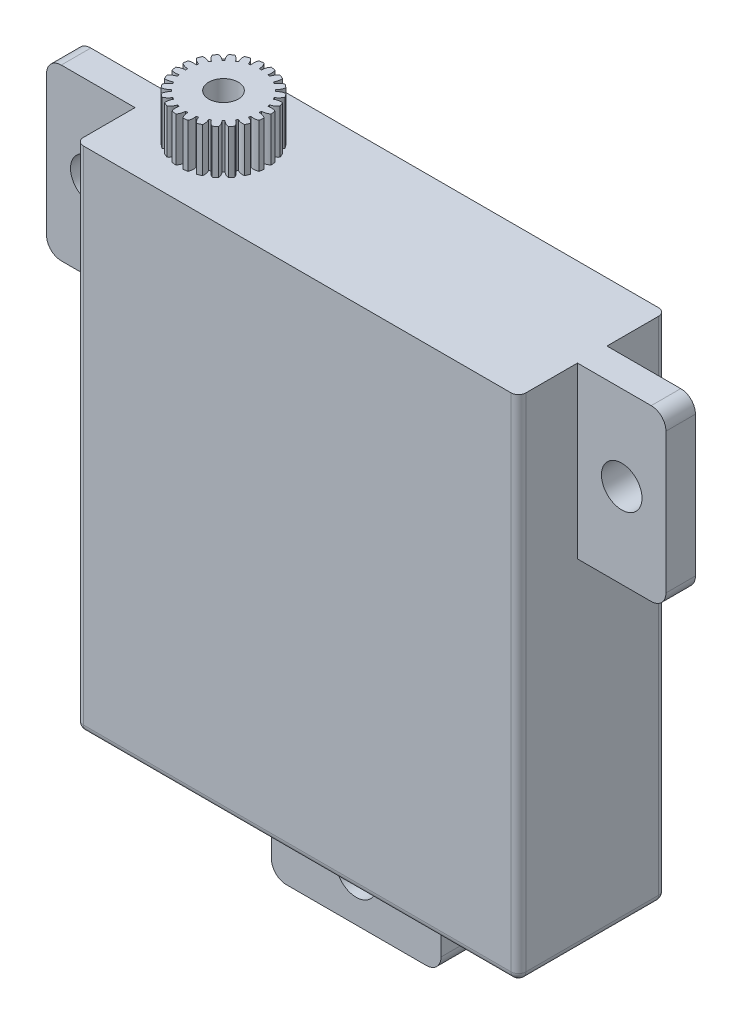
from build123d import *

# Parameters (mm, degrees)
SKETCH1_W           = 30
SKETCH1_H           = 34.5
BOSS_EXTRUDE1_DEPTH = 10
SKETCH2_W           = 2
SKETCH2_H           = 11.5
BOSS_EXTRUDE4_DEPTH = 21
SKETCH3_W           = 11.5
SKETCH3_H           = 2
BOSS_EXTRUDE5_DEPTH = 6
FILLET2_R           = 1
SKETCH4_R           = 1.375
CUT_EXTRUDE1_DEPTH  = 10
FILLET3_R           = 0.5
SKETCH5_W           = 2.5
SKETCH5_H           = 6
CUT_EXTRUDE2_DEPTH  = 1
SKETCH6_R           = 3
SKETCH6_R_2         = 1
BOSS_EXTRUDE6_DEPTH = 3
CUT_EXTRUDE3_START  = -3
CUT_EXTRUDE3_DEPTH  = 3
CIRPATTERN1_COUNT   = 24


with BuildPart() as part:
    # Sketch1 → Boss-Extrude1 (new body)
    with BuildSketch(Plane.XY):
        with Locations((0.31359995, -1.512440758)):
            Rectangle(SKETCH1_W, SKETCH1_H)
    extrude(amount=BOSS_EXTRUDE1_DEPTH)

    # Sketch2 → Boss-Extrude4 (add, symmetric)
    with BuildSketch(Plane(origin=(0.31359995, 0, 0), x_dir=(0, 0, -1), z_dir=(1, 0, 0))):
        with Locations((-5, 9.987559242)):
            Rectangle(SKETCH2_W, SKETCH2_H)
    extrude(amount=BOSS_EXTRUDE4_DEPTH, both=True)

    # Sketch3 → Boss-Extrude5 (add)
    with BuildSketch(Plane.XZ.offset(18.762440758)):
        with Locations((0.31359995, 5)):
            Rectangle(SKETCH3_W, SKETCH3_H)
    extrude(amount=BOSS_EXTRUDE5_DEPTH)

    # Fillet2
    fillet2_edges = [part.edges().sort_by_distance(p)[0] for p in [
        (21.31359995, 15.737559242, 5),
        (-20.68640005, 4.237559242, 5),
        (21.31359995, 4.237559242, 5),
        (-20.68640005, 15.737559242, 5),
        (-5.43640005, -24.762440758, 5),
        (6.06359995, -24.762440758, 5),
    ]]
    fillet(fillet2_edges, radius=FILLET2_R)

    # Sketch4 → Cut-Extrude1 (cut)
    with BuildSketch(Plane.XY.offset(10)):
        with Locations((-17.68640005, 9.987559242)):
            Circle(SKETCH4_R)
        with Locations((18.31359995, 9.987559242)):
            Circle(SKETCH4_R)
        with Locations((0.31359995, -21.762440758)):
            Circle(SKETCH4_R)
    extrude(amount=-CUT_EXTRUDE1_DEPTH, mode=Mode.SUBTRACT)

    # Fillet3
    fillet3_edges = [part.edges().sort_by_distance(p)[0] for p in [
        (15.31359995, -1.512440758, 10),
        (-14.68640005, -1.512440758, 10),
        (15.31359995, -1.512440758, 0),
        (0.31359995, -18.762440758, 0),
        (-14.68640005, -1.512440758, 0),
        (15.31359995, -18.762440758, 5),
        (-14.68640005, -18.762440758, 5),
        (0.31359995, -18.762440758, 10),
    ]]
    fillet(fillet3_edges, radius=FILLET3_R)

    # Sketch5 → Cut-Extrude2 (cut)
    with BuildSketch(Plane.ZY.offset(14.68640005)):
        with Locations((5, -10.262440758)):
            Rectangle(SKETCH5_W, SKETCH5_H)
    extrude(amount=-CUT_EXTRUDE2_DEPTH, mode=Mode.SUBTRACT)

    # Sketch6 → Boss-Extrude6 (add)
    with BuildSketch(Plane(origin=(0, 15.737559242, 0), x_dir=(1, 0, 0), z_dir=(0, 1, 0))):
        with Locations(Location((-9.68640005, -5, 0), (0, 0, 90))):
            Circle(SKETCH6_R)
        with Locations(Location((-9.68640005, -5, 0), (0, 0, 270))):
            Circle(SKETCH6_R_2, mode=Mode.SUBTRACT)
    extrude(amount=BOSS_EXTRUDE6_DEPTH)

    # Sketch7 → Cut-Extrude3 (cut)
    with BuildSketch(Plane(origin=(0, 18.737559242, 0), x_dir=(1, 0, 0), z_dir=(0, 1, 0)).offset(CUT_EXTRUDE3_START)):
        with BuildLine():
            Line((-9.68640005, -2), (-9.68640005, -2.5))
            Line((-9.68640005, -2.5), (-9.61140005, -2.5))
            ThreePointArc((-9.61140005, -2.5), (-9.571129509, -2.240512735), (-9.446003633, -2.009647251))
            ThreePointArc((-9.446003633, -2.009647251), (-9.566105093, -2.002412783), (-9.68640005, -2))
        make_face()
        with BuildLine():
            Line((-9.76140005, -2.5), (-9.68640005, -2.5))
            Line((-9.68640005, -2.5), (-9.68640005, -2))
            ThreePointArc((-9.68640005, -2), (-9.806695006, -2.002412783), (-9.926796466, -2.009647251))
            ThreePointArc((-9.926796466, -2.009647251), (-9.80167059, -2.240512735), (-9.76140005, -2.5))
        make_face()
    cut_extrude3 = extrude(amount=CUT_EXTRUDE3_DEPTH, mode=Mode.SUBTRACT)

    # CirPattern1: Cut-Extrude3 ×24 about axis
    cirpattern1_axis = Axis((-9.68640005, 0, 5), (0, 1, 0))
    for i in range(1, CIRPATTERN1_COUNT):
        add(cut_extrude3.rotate(cirpattern1_axis, i * 360 / CIRPATTERN1_COUNT), mode=Mode.SUBTRACT)


solid = part.part
